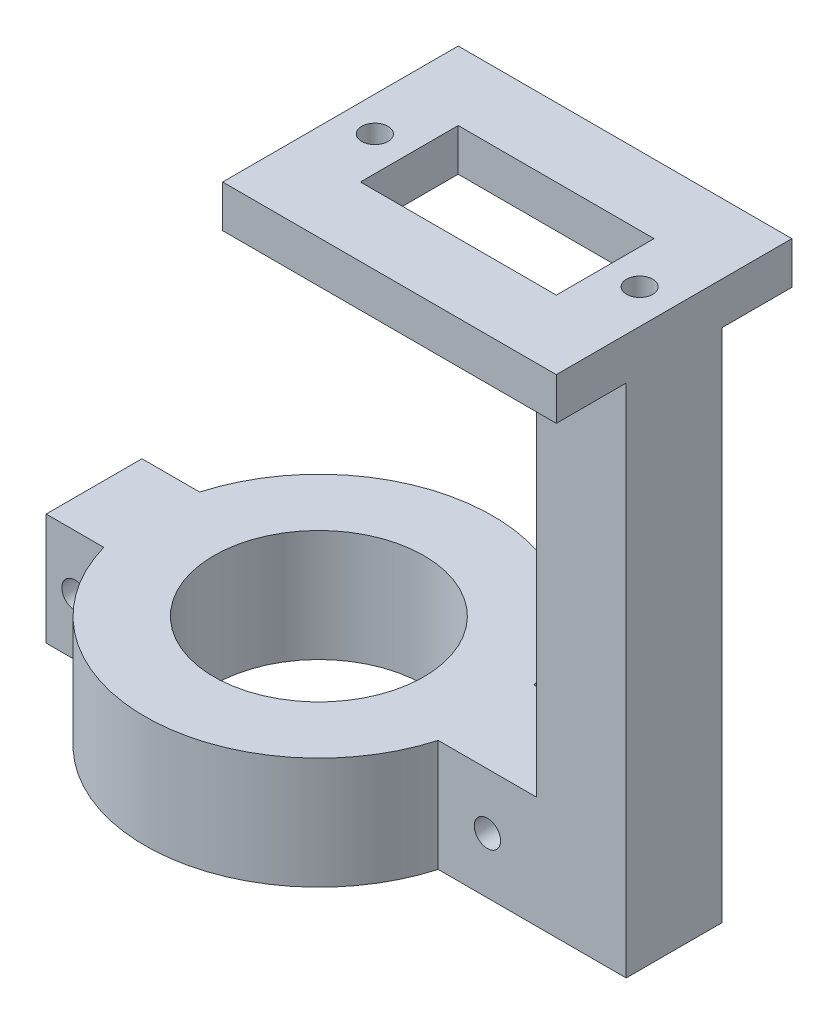
from build123d import *

# Parameters (mm, degrees)
SKETCH_1_W          = 48.45
SKETCH_1_H          = 34.2
SKETCH_1_W_2        = 28.45
SKETCH_1_H_2        = 14.2
EXTRUDE_1_DEPTH     = 12.25
SKETCH_2_R          = 1.91
CUT_EXTRUDE_1_DEPTH = 33.083066016
SKETCH_4_W          = 13
SKETCH_4_H          = 13.91
EXTRUDE_1_2_DEPTH   = 74.82
SKETCH_5_W          = 13.91
SKETCH_5_H          = 16.23
EXTRUDE_2_DEPTH     = 16
SKETCH_7_R          = 25.25
SKETCH_7_R_2        = 15.25
EXTRUDE_2_2_DEPTH   = 16.23
SKETCH_15_R         = 1.91
CUT_EXTRUDE_6_DEPTH = 97.964478439
SKETCH_16_W         = 13.91
SKETCH_16_H         = 16.23
EXTRUDE_4_DEPTH     = 10
SKETCH_17_R         = 1.91
CUT_EXTRUDE_7_DEPTH = 102.16913771
SKETCH_18_W         = 48.429544624
SKETCH_18_H         = 6.125
CUT_EXTRUDE_8_DEPTH = 105.840616652
SKETCH_19_W         = 34.2
SKETCH_19_H         = 6.125
CUT_EXTRUDE_9_DEPTH = 10


with BuildPart() as part:
    # 草圖1 → Extrude 1 (new body)
    with BuildSketch(Plane(origin=(0, 0, 0), x_dir=(1, 0, 0), z_dir=(0, 1, 0))):
        Rectangle(SKETCH_1_W, SKETCH_1_H)
        Rectangle(SKETCH_1_W_2, SKETCH_1_H_2, mode=Mode.SUBTRACT)
    extrude(amount=EXTRUDE_1_DEPTH)

    # 草圖2 → 除料-伸長1 (cut, through all)
    with BuildSketch(Plane(origin=(0, 12.25, 0), x_dir=(1, 0, 0), z_dir=(0, 1, 0))):
        with Locations(Location((-19.225, 0, 0), (0, 0, 270))):
            Circle(SKETCH_2_R)
        with Locations(Location((19.225, 0, 0), (0, 0, 270))):
            Circle(SKETCH_2_R)
    extrude(amount=-CUT_EXTRUDE_1_DEPTH, mode=Mode.SUBTRACT)

    # 草圖4 → Extrude 1 2 (add)
    with BuildSketch(Plane.XZ):
        with Locations((17.725, 0)):
            Rectangle(SKETCH_4_W, SKETCH_4_H)
    extrude(amount=EXTRUDE_1_2_DEPTH)

    # 草圖5 → Extrude 2 (add)
    with BuildSketch(Plane.ZY.offset(-11.225)):
        with Locations((0, -66.705)):
            Rectangle(SKETCH_5_W, SKETCH_5_H)
    extrude(amount=EXTRUDE_2_DEPTH)

    # 草圖7 → Extrude 2 2 (add)
    with BuildSketch(Plane(origin=(3.626674765, -74.82, 0), x_dir=(1, 0, 0), z_dir=(0, -1, 0))):
        with Locations((-30.978154344, 0)):
            Circle(SKETCH_7_R)
        with Locations((-30.978154344, 0)):
            Circle(SKETCH_7_R_2, mode=Mode.SUBTRACT)
    extrude(amount=-EXTRUDE_2_2_DEPTH)

    # 草圖15 → 除料-伸長6 (cut, through all)
    with BuildSketch(Plane(origin=(0, 0, -6.955), x_dir=(-1, 0, 0), z_dir=(0, 0, -1))):
        with Locations((-4.073383248, -66.705)):
            Circle(SKETCH_15_R)
    extrude(amount=-CUT_EXTRUDE_6_DEPTH, mode=Mode.SUBTRACT)

    # 草圖16 → 填料-伸長4 (add)
    with BuildSketch(Plane(origin=(-60, 0, 0), x_dir=(0, 0, -1), z_dir=(1, 0, 0))):
        with Locations((0, -66.705)):
            Rectangle(SKETCH_16_W, SKETCH_16_H)
    extrude(amount=EXTRUDE_4_DEPTH)

    # 草圖17 → 除料-伸長7 (cut, through all)
    with BuildSketch(Plane(origin=(0, 0, -6.955), x_dir=(-1, 0, 0), z_dir=(0, 0, -1))):
        with Locations((55.812362827, -66.705)):
            Circle(SKETCH_17_R)
    extrude(amount=-CUT_EXTRUDE_7_DEPTH, mode=Mode.SUBTRACT)

    # 草圖18 → 除料-伸長8 (cut, through all)
    with BuildSketch(Plane(origin=(0, 0, -17.1), x_dir=(-1, 0, 0), z_dir=(0, 0, -1))):
        with Locations((0.010227688, 9.1875)):
            Rectangle(SKETCH_18_W, SKETCH_18_H)
    extrude(amount=-CUT_EXTRUDE_8_DEPTH, mode=Mode.SUBTRACT)

    # 草圖19 → 除料-伸長9 (cut)
    with BuildSketch(Plane.ZY.offset(-24.204544624)):
        with Locations((0, 9.1875)):
            Rectangle(SKETCH_19_W, SKETCH_19_H)
    extrude(amount=-CUT_EXTRUDE_9_DEPTH, mode=Mode.SUBTRACT)


solid = part.part
